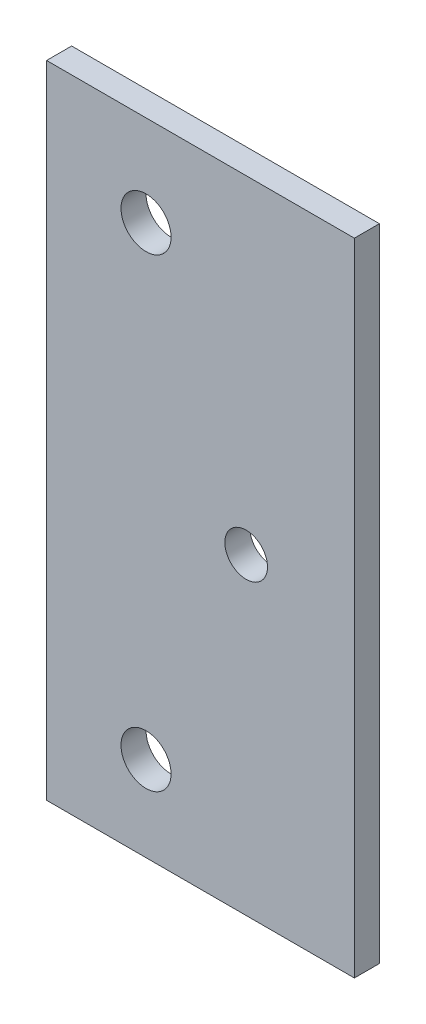
from build123d import *

# Parameters (mm, degrees)
SKETCH1_W               = 39.032335112
SKETCH1_H               = 81.259338173
SKETCH1_R               = 3.175
BOSS_EXTRUDE1_DEPTH     = 3.175
F_1_4_28_TAPPED_HOLE1_D = 5.4102


with BuildPart() as part:
    # Sketch1 → Boss-Extrude1 (new body)
    with BuildSketch(Plane.XY):
        with Locations((-69.293997496, 206.742821462)):
            Rectangle(SKETCH1_W, SKETCH1_H)
        with Locations((-76.2, 235.857142857)):
            Circle(SKETCH1_R, mode=Mode.SUBTRACT)
        with Locations((-76.2, 176.892857143)):
            Circle(SKETCH1_R, mode=Mode.SUBTRACT)
    extrude(amount=BOSS_EXTRUDE1_DEPTH)

    # 1/4-28 Tapped Hole1 (through all)
    with Locations(Plane.XY.offset(3.175)):
        with Locations((-63.5, 205.74)):
            Hole(F_1_4_28_TAPPED_HOLE1_D / 2)


solid = part.part
